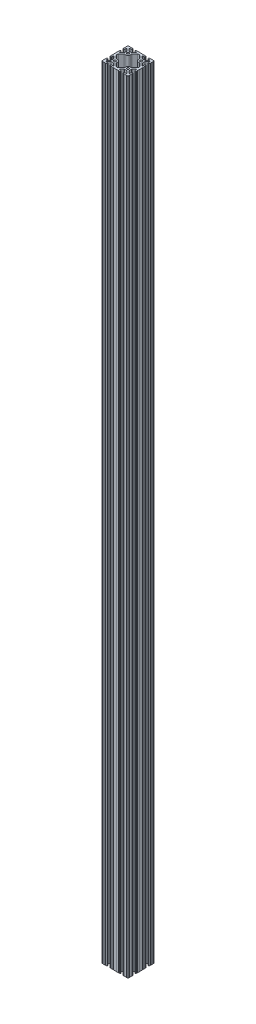
from build123d import *

# Parameters (mm, degrees)
SCHIZZO1_R                   = 2.62
ESTRUSIONE_ESTRUSIONE1_DEPTH = 1780


with BuildPart() as part:
    # Schizzo1 → Estrusione-Estrusione1 (new body)
    with BuildSketch(Plane.XZ):
        with BuildLine():
            Line((10.4, 0), (8.4, 0))
            ThreePointArc((8.4, 0), (8, -0.4), (7.6, 0))
            Line((7.6, 0), (3, 0))
            ThreePointArc((3, 0), (2.6, -0.4), (2.2, 0))
            Line((2.2, 0), (2, 0))
            ThreePointArc((2, 0), (0.585786438, -0.585786438), (0, -2))
            Line((0, -2), (0, -2.2))
            ThreePointArc((0, -2.2), (0.4, -2.6), (0, -3))
            Line((0, -3), (0, -7.6))
            ThreePointArc((0, -7.6), (0.4, -8), (0, -8.4))
            Line((0, -8.4), (0, -10.4))
            ThreePointArc((0, -10.4), (0.410050506, -11.389949494), (1.4, -11.8))
            Line((1.4, -11.8), (1.8, -11.8))
            ThreePointArc((1.8, -11.8), (2.789949494, -11.389949494), (3.2, -10.4))
            Line((3.2, -10.4), (3.2, -7.35411255))
            ThreePointArc((3.2, -7.35411255), (3.693853254, -6.615008924), (4.565685425, -6.788427125))
            Line((4.565685425, -6.788427125), (8.954213562, -11.176955262))
            ThreePointArc((8.954213562, -11.176955262), (9.387759065, -11.82580196), (9.54, -12.591168825))
            Line((9.54, -12.591168825), (9.54, -17.371572875))
            ThreePointArc((9.54, -17.371572875), (9.387759065, -18.13693974), (8.954213562, -18.785786438))
            Line((8.954213562, -18.785786438), (4.565685425, -23.174314575))
            ThreePointArc((4.565685425, -23.174314575), (3.693853254, -23.347732776), (3.2, -22.60862915))
            Line((3.2, -22.60862915), (3.2, -19.6))
            ThreePointArc((3.2, -19.6), (2.789949494, -18.610050506), (1.8, -18.2))
            Line((1.8, -18.2), (1.4, -18.2))
            ThreePointArc((1.4, -18.2), (0.410050506, -18.610050506), (0, -19.6))
            Line((0, -19.6), (0, -20.4))
            ThreePointArc((0, -20.4), (0.4, -20.8), (0, -21.2))
            Line((0, -21.2), (0, -25.8))
            ThreePointArc((0, -25.8), (0.4, -26.2), (0, -26.6))
            Line((0, -26.6), (0, -33.4))
            ThreePointArc((0, -33.4), (0.4, -33.8), (0, -34.2))
            Line((0, -34.2), (0, -38.8))
            ThreePointArc((0, -38.8), (0.4, -39.2), (0, -39.6))
            Line((0, -39.6), (0, -40.4))
            ThreePointArc((0, -40.4), (0.410050506, -41.389949494), (1.4, -41.8))
            Line((1.4, -41.8), (1.8, -41.8))
            ThreePointArc((1.8, -41.8), (2.789949494, -41.389949494), (3.2, -40.4))
            Line((3.2, -40.4), (3.2, -37.39137085))
            ThreePointArc((3.2, -37.39137085), (3.693853254, -36.652267224), (4.565685425, -36.825685425))
            Line((4.565685425, -36.825685425), (8.954213562, -41.214213562))
            ThreePointArc((8.954213562, -41.214213562), (9.387759065, -41.86306026), (9.54, -42.628427125))
            Line((9.54, -42.628427125), (9.54, -47.408831175))
            ThreePointArc((9.54, -47.408831175), (9.387759065, -48.17419804), (8.954213562, -48.823044738))
            Line((8.954213562, -48.823044738), (4.565685425, -53.211572875))
            ThreePointArc((4.565685425, -53.211572875), (3.693853254, -53.384991076), (3.2, -52.64588745))
            Line((3.2, -52.64588745), (3.2, -49.6))
            ThreePointArc((3.2, -49.6), (2.789949494, -48.610050506), (1.8, -48.2))
            Line((1.8, -48.2), (1.4, -48.2))
            ThreePointArc((1.4, -48.2), (0.410050506, -48.610050506), (0, -49.6))
            Line((0, -49.6), (0, -51.6))
            ThreePointArc((0, -51.6), (0.4, -52), (0, -52.4))
            Line((0, -52.4), (0, -57))
            ThreePointArc((0, -57), (0.4, -57.4), (0, -57.8))
            Line((0, -57.8), (0, -58))
            ThreePointArc((0, -58), (0.585786438, -59.414213562), (2, -60))
            Line((2, -60), (2.2, -60))
            ThreePointArc((2.2, -60), (2.6, -59.6), (3, -60))
            Line((3, -60), (7.6, -60))
            ThreePointArc((7.6, -60), (8, -59.6), (8.4, -60))
            Line((8.4, -60), (10.4, -60))
            ThreePointArc((10.4, -60), (11.389949494, -59.589949494), (11.8, -58.6))
            Line((11.8, -58.6), (11.8, -58.2))
            ThreePointArc((11.8, -58.2), (11.389949494, -57.210050506), (10.4, -56.8))
            Line((10.4, -56.8), (7.35411255, -56.8))
            ThreePointArc((7.35411255, -56.8), (6.615008924, -56.306146746), (6.788427125, -55.434314575))
            Line((6.788427125, -55.434314575), (11.176955262, -51.045786438))
            ThreePointArc((11.176955262, -51.045786438), (11.82580196, -50.612240935), (12.591168825, -50.46))
            Line((12.591168825, -50.46), (17.371572875, -50.46))
            ThreePointArc((17.371572875, -50.46), (18.13693974, -50.612240935), (18.785786438, -51.045786438))
            Line((18.785786438, -51.045786438), (23.174314575, -55.434314575))
            ThreePointArc((23.174314575, -55.434314575), (23.347732776, -56.306146746), (22.60862915, -56.8))
            Line((22.60862915, -56.8), (19.6, -56.8))
            ThreePointArc((19.6, -56.8), (18.610050506, -57.210050506), (18.2, -58.2))
            Line((18.2, -58.2), (18.2, -58.6))
            ThreePointArc((18.2, -58.6), (18.610050506, -59.589949494), (19.6, -60))
            Line((19.6, -60), (20.4, -60))
            ThreePointArc((20.4, -60), (20.8, -59.6), (21.2, -60))
            Line((21.2, -60), (25.8, -60))
            ThreePointArc((25.8, -60), (26.2, -59.6), (26.6, -60))
            Line((26.6, -60), (33.4, -60))
            ThreePointArc((33.4, -60), (33.8, -59.6), (34.2, -60))
            Line((34.2, -60), (38.8, -60))
            ThreePointArc((38.8, -60), (39.2, -59.6), (39.6, -60))
            Line((39.6, -60), (40.4, -60))
            ThreePointArc((40.4, -60), (41.389949494, -59.589949494), (41.8, -58.6))
            Line((41.8, -58.6), (41.8, -58.2))
            ThreePointArc((41.8, -58.2), (41.389949494, -57.210050506), (40.4, -56.8))
            Line((40.4, -56.8), (37.39137085, -56.8))
            ThreePointArc((37.39137085, -56.8), (36.652267224, -56.306146746), (36.825685425, -55.434314575))
            Line((36.825685425, -55.434314575), (41.214213562, -51.045786438))
            ThreePointArc((41.214213562, -51.045786438), (41.86306026, -50.612240935), (42.628427125, -50.46))
            Line((42.628427125, -50.46), (47.408831175, -50.46))
            ThreePointArc((47.408831175, -50.46), (48.17419804, -50.612240935), (48.823044738, -51.045786438))
            Line((48.823044738, -51.045786438), (53.211572875, -55.434314575))
            ThreePointArc((53.211572875, -55.434314575), (53.384991076, -56.306146746), (52.64588745, -56.8))
            Line((52.64588745, -56.8), (49.6, -56.8))
            ThreePointArc((49.6, -56.8), (48.610050506, -57.210050506), (48.2, -58.2))
            Line((48.2, -58.2), (48.2, -58.6))
            ThreePointArc((48.2, -58.6), (48.610050506, -59.589949494), (49.6, -60))
            Line((49.6, -60), (51.6, -60))
            ThreePointArc((51.6, -60), (52, -59.6), (52.4, -60))
            Line((52.4, -60), (57, -60))
            ThreePointArc((57, -60), (57.4, -59.6), (57.8, -60))
            Line((57.8, -60), (58, -60))
            ThreePointArc((58, -60), (59.414213562, -59.414213562), (60, -58))
            Line((60, -58), (60, -57.8))
            ThreePointArc((60, -57.8), (59.6, -57.4), (60, -57))
            Line((60, -57), (60, -52.4))
            ThreePointArc((60, -52.4), (59.6, -52), (60, -51.6))
            Line((60, -51.6), (60, -49.6))
            ThreePointArc((60, -49.6), (59.589949494, -48.610050506), (58.6, -48.2))
            Line((58.6, -48.2), (58.2, -48.2))
            ThreePointArc((58.2, -48.2), (57.210050506, -48.610050506), (56.8, -49.6))
            Line((56.8, -49.6), (56.8, -52.64588745))
            ThreePointArc((56.8, -52.64588745), (56.306146746, -53.384991076), (55.434314575, -53.211572875))
            Line((55.434314575, -53.211572875), (51.045786438, -48.823044738))
            ThreePointArc((51.045786438, -48.823044738), (50.612240935, -48.17419804), (50.46, -47.408831175))
            Line((50.46, -47.408831175), (50.46, -42.628427125))
            ThreePointArc((50.46, -42.628427125), (50.612240935, -41.86306026), (51.045786438, -41.214213562))
            Line((51.045786438, -41.214213562), (55.434314575, -36.825685425))
            ThreePointArc((55.434314575, -36.825685425), (56.306146746, -36.652267224), (56.8, -37.39137085))
            Line((56.8, -37.39137085), (56.8, -40.4))
            ThreePointArc((56.8, -40.4), (57.210050506, -41.389949494), (58.2, -41.8))
            Line((58.2, -41.8), (58.6, -41.8))
            ThreePointArc((58.6, -41.8), (59.589949494, -41.389949494), (60, -40.4))
            Line((60, -40.4), (60, -39.6))
            ThreePointArc((60, -39.6), (59.6, -39.2), (60, -38.8))
            Line((60, -38.8), (60, -34.2))
            ThreePointArc((60, -34.2), (59.6, -33.8), (60, -33.4))
            Line((60, -33.4), (60, -26.6))
            ThreePointArc((60, -26.6), (59.6, -26.2), (60, -25.8))
            Line((60, -25.8), (60, -21.2))
            ThreePointArc((60, -21.2), (59.6, -20.8), (60, -20.4))
            Line((60, -20.4), (60, -19.6))
            ThreePointArc((60, -19.6), (59.589949494, -18.610050506), (58.6, -18.2))
            Line((58.6, -18.2), (58.2, -18.2))
            ThreePointArc((58.2, -18.2), (57.210050506, -18.610050506), (56.8, -19.6))
            Line((56.8, -19.6), (56.8, -22.60862915))
            ThreePointArc((56.8, -22.60862915), (56.306146746, -23.347732776), (55.434314575, -23.174314575))
            Line((55.434314575, -23.174314575), (51.045786438, -18.785786438))
            ThreePointArc((51.045786438, -18.785786438), (50.612240935, -18.13693974), (50.46, -17.371572875))
            Line((50.46, -17.371572875), (50.46, -12.591168825))
            ThreePointArc((50.46, -12.591168825), (50.612240935, -11.82580196), (51.045786438, -11.176955262))
            Line((51.045786438, -11.176955262), (55.434314575, -6.788427125))
            ThreePointArc((55.434314575, -6.788427125), (56.306146746, -6.615008924), (56.8, -7.35411255))
            Line((56.8, -7.35411255), (56.8, -10.4))
            ThreePointArc((56.8, -10.4), (57.210050506, -11.389949494), (58.2, -11.8))
            Line((58.2, -11.8), (58.6, -11.8))
            ThreePointArc((58.6, -11.8), (59.589949494, -11.389949494), (60, -10.4))
            Line((60, -10.4), (60, -8.4))
            ThreePointArc((60, -8.4), (59.6, -8), (60, -7.6))
            Line((60, -7.6), (60, -3))
            ThreePointArc((60, -3), (59.6, -2.6), (60, -2.2))
            Line((60, -2.2), (60, -2))
            ThreePointArc((60, -2), (59.414213562, -0.585786438), (58, 0))
            Line((58, 0), (57.8, 0))
            ThreePointArc((57.8, 0), (57.4, -0.4), (57, 0))
            Line((57, 0), (52.4, 0))
            ThreePointArc((52.4, 0), (52, -0.4), (51.6, 0))
            Line((51.6, 0), (49.6, 0))
            ThreePointArc((49.6, 0), (48.610050506, -0.410050506), (48.2, -1.4))
            Line((48.2, -1.4), (48.2, -1.8))
            ThreePointArc((48.2, -1.8), (48.610050506, -2.789949494), (49.6, -3.2))
            Line((49.6, -3.2), (52.64588745, -3.2))
            ThreePointArc((52.64588745, -3.2), (53.384991076, -3.693853254), (53.211572875, -4.565685425))
            Line((53.211572875, -4.565685425), (48.823044738, -8.954213562))
            ThreePointArc((48.823044738, -8.954213562), (48.17419804, -9.387759065), (47.408831175, -9.54))
            Line((47.408831175, -9.54), (42.628427125, -9.54))
            ThreePointArc((42.628427125, -9.54), (41.86306026, -9.387759065), (41.214213562, -8.954213562))
            Line((41.214213562, -8.954213562), (36.825685425, -4.565685425))
            ThreePointArc((36.825685425, -4.565685425), (36.652267224, -3.693853254), (37.39137085, -3.2))
            Line((37.39137085, -3.2), (40.4, -3.2))
            ThreePointArc((40.4, -3.2), (41.389949494, -2.789949494), (41.8, -1.8))
            Line((41.8, -1.8), (41.8, -1.4))
            ThreePointArc((41.8, -1.4), (41.389949494, -0.410050506), (40.4, 0))
            Line((40.4, 0), (39.6, 0))
            ThreePointArc((39.6, 0), (39.2, -0.4), (38.8, 0))
            Line((38.8, 0), (34.2, 0))
            ThreePointArc((34.2, 0), (33.8, -0.4), (33.4, 0))
            Line((33.4, 0), (26.6, 0))
            ThreePointArc((26.6, 0), (26.2, -0.4), (25.8, 0))
            Line((25.8, 0), (21.2, 0))
            ThreePointArc((21.2, 0), (20.8, -0.4), (20.4, 0))
            Line((20.4, 0), (19.6, 0))
            ThreePointArc((19.6, 0), (18.610050506, -0.410050506), (18.2, -1.4))
            Line((18.2, -1.4), (18.2, -1.8))
            ThreePointArc((18.2, -1.8), (18.610050506, -2.789949494), (19.6, -3.2))
            Line((19.6, -3.2), (22.60862915, -3.2))
            ThreePointArc((22.60862915, -3.2), (23.347732776, -3.693853254), (23.174314575, -4.565685425))
            Line((23.174314575, -4.565685425), (18.785786438, -8.954213562))
            ThreePointArc((18.785786438, -8.954213562), (18.13693974, -9.387759065), (17.371572875, -9.54))
            Line((17.371572875, -9.54), (12.591168825, -9.54))
            ThreePointArc((12.591168825, -9.54), (11.82580196, -9.387759065), (11.176955262, -8.954213562))
            Line((11.176955262, -8.954213562), (6.788427125, -4.565685425))
            ThreePointArc((6.788427125, -4.565685425), (6.615008924, -3.693853254), (7.35411255, -3.2))
            Line((7.35411255, -3.2), (10.4, -3.2))
            ThreePointArc((10.4, -3.2), (11.389949494, -2.789949494), (11.8, -1.8))
            Line((11.8, -1.8), (11.8, -1.4))
            ThreePointArc((11.8, -1.4), (11.389949494, -0.410050506), (10.4, 0))
        make_face()
        with Locations(Location((15.003749624, -15.003749624, 0), (0, 0, 90))):
            Circle(SCHIZZO1_R, mode=Mode.SUBTRACT)
        with Locations(Location((44.996250376, -15.003749624, 0), (0, 0, 90))):
            Circle(SCHIZZO1_R, mode=Mode.SUBTRACT)
        with Locations(Location((44.996250376, -44.996250376, 0), (0, 0, 90))):
            Circle(SCHIZZO1_R, mode=Mode.SUBTRACT)
        with Locations(Location((15.003749624, -44.996250376, 0), (0, 0, 90))):
            Circle(SCHIZZO1_R, mode=Mode.SUBTRACT)
        with BuildLine():
            Line((16.503749624, -39.496250376), (13.5246775, -39.496250376))
            ThreePointArc((13.5246775, -39.496250376), (12.759310636, -39.344009441), (12.110463938, -38.910463938))
            Line((12.110463938, -38.910463938), (6.028427125, -32.828427125))
            ThreePointArc((6.028427125, -32.828427125), (4.856854249, -30), (6.028427125, -27.171572875))
            Line((6.028427125, -27.171572875), (12.110463938, -21.089536062))
            ThreePointArc((12.110463938, -21.089536062), (12.759310636, -20.655990559), (13.5246775, -20.503749624))
            Line((13.5246775, -20.503749624), (16.503749624, -20.503749624))
            ThreePointArc((16.503749624, -20.503749624), (19.332176749, -19.332176749), (20.503749624, -16.503749624))
            Line((20.503749624, -16.503749624), (20.503749624, -13.5246775))
            ThreePointArc((20.503749624, -13.5246775), (20.655990559, -12.759310636), (21.089536062, -12.110463938))
            Line((21.089536062, -12.110463938), (27.171572875, -6.028427125))
            ThreePointArc((27.171572875, -6.028427125), (30, -4.856854249), (32.828427125, -6.028427125))
            Line((32.828427125, -6.028427125), (38.910463938, -12.110463938))
            ThreePointArc((38.910463938, -12.110463938), (39.344009441, -12.759310636), (39.496250376, -13.5246775))
            Line((39.496250376, -13.5246775), (39.496250376, -16.503749624))
            ThreePointArc((39.496250376, -16.503749624), (40.667823251, -19.332176749), (43.496250376, -20.503749624))
            Line((43.496250376, -20.503749624), (46.4753225, -20.503749624))
            ThreePointArc((46.4753225, -20.503749624), (47.240689364, -20.655990559), (47.889536062, -21.089536062))
            Line((47.889536062, -21.089536062), (53.971572875, -27.171572875))
            ThreePointArc((53.971572875, -27.171572875), (55.143145751, -30), (53.971572875, -32.828427125))
            Line((53.971572875, -32.828427125), (47.889536062, -38.910463938))
            ThreePointArc((47.889536062, -38.910463938), (47.240689364, -39.344009441), (46.4753225, -39.496250376))
            Line((46.4753225, -39.496250376), (43.496250376, -39.496250376))
            ThreePointArc((43.496250376, -39.496250376), (40.667823251, -40.667823251), (39.496250376, -43.496250376))
            Line((39.496250376, -43.496250376), (39.496250376, -46.4753225))
            ThreePointArc((39.496250376, -46.4753225), (39.344009441, -47.240689364), (38.910463938, -47.889536062))
            Line((38.910463938, -47.889536062), (32.828427125, -53.971572875))
            ThreePointArc((32.828427125, -53.971572875), (30, -55.143145751), (27.171572875, -53.971572875))
            Line((27.171572875, -53.971572875), (21.089536062, -47.889536062))
            ThreePointArc((21.089536062, -47.889536062), (20.655990559, -47.240689364), (20.503749624, -46.4753225))
            Line((20.503749624, -46.4753225), (20.503749624, -43.496250376))
            ThreePointArc((20.503749624, -43.496250376), (19.332176749, -40.667823251), (16.503749624, -39.496250376))
        make_face(mode=Mode.SUBTRACT)
    extrude(amount=-ESTRUSIONE_ESTRUSIONE1_DEPTH)


solid = part.part
